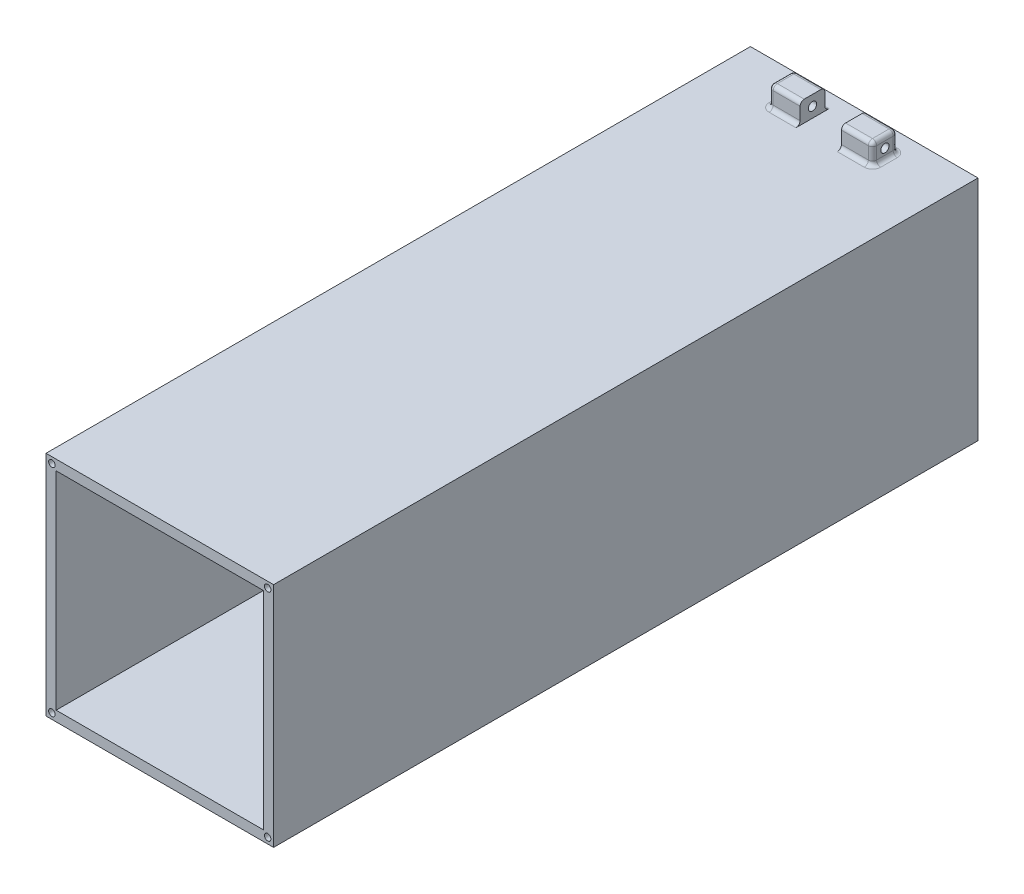
from build123d import *

# Parameters (mm, degrees)
SKETCH1_W                = 110
SKETCH1_H                = 110
SKETCH1_W_2              = 100.2
SKETCH1_H_2              = 100.2
BOSS_EXTRUDE1_DEPTH      = 340.5
CUT_EXTRUDE1_REACH       = 351.271
SKETCH2_R                = 1.575
BOSS_EXTRUDE3_DEPTH      = 30
BOSS_EXTRUDE3_DEPTH_BACK = 30
SKETCH3_W                = 10
SKETCH3_H                = 10
SKETCH4_R                = 1.5
CUT_EXTRUDE2_DEPTH       = 60
SKETCH6_W                = 15
SKETCH6_H                = 12
BOSS_EXTRUDE4_DEPTH      = 10
CUT_EXTRUDE3_REACH       = 357.76
SKETCH7_R                = 2
FILLET1_R                = 2
FILLET2_R                = 3


with BuildPart() as part:
    # Sketch1 → Boss-Extrude1 (new body)
    with BuildSketch(Plane.XY):
        Rectangle(SKETCH1_W, SKETCH1_H)
        Rectangle(SKETCH1_W_2, SKETCH1_H_2, mode=Mode.SUBTRACT)
    extrude(amount=BOSS_EXTRUDE1_DEPTH)

    # Sketch2 → Cut-Extrude1 (cut, up to next)
    with BuildSketch(Plane.XY.offset(340.5), mode=Mode.PRIVATE) as cut_extrude1_sk1:
        with Locations((-52.149125113, 52.149125113)):
            Circle(SKETCH2_R)
    cut_extrude1_tool1 = extrude(cut_extrude1_sk1.sketch, amount=-CUT_EXTRUDE1_REACH, mode=Mode.PRIVATE) & part.part
    # Sketch2 → Cut-Extrude1 (cut, up to next)
    with BuildSketch(Plane.XY.offset(340.5), mode=Mode.PRIVATE) as cut_extrude1_sk2:
        with Locations((52.149125113, 52.149125113)):
            Circle(SKETCH2_R)
    cut_extrude1_tool2 = extrude(cut_extrude1_sk2.sketch, amount=-CUT_EXTRUDE1_REACH, mode=Mode.PRIVATE) & part.part
    # Sketch2 → Cut-Extrude1 (cut, up to next)
    with BuildSketch(Plane.XY.offset(340.5), mode=Mode.PRIVATE) as cut_extrude1_sk3:
        with Locations((52.149125113, -52.149125113)):
            Circle(SKETCH2_R)
    cut_extrude1_tool3 = extrude(cut_extrude1_sk3.sketch, amount=-CUT_EXTRUDE1_REACH, mode=Mode.PRIVATE) & part.part
    # Sketch2 → Cut-Extrude1 (cut, up to next)
    with BuildSketch(Plane.XY.offset(340.5), mode=Mode.PRIVATE) as cut_extrude1_sk4:
        with Locations((-52.149125113, -52.149125113)):
            Circle(SKETCH2_R)
    cut_extrude1_tool4 = extrude(cut_extrude1_sk4.sketch, amount=-CUT_EXTRUDE1_REACH, mode=Mode.PRIVATE) & part.part
    add(cut_extrude1_tool1.solids().sort_by_distance((-52.149125, 52.149125, 340.5))[0], mode=Mode.SUBTRACT)
    add(cut_extrude1_tool2.solids().sort_by_distance((52.149125, 52.149125, 340.5))[0], mode=Mode.SUBTRACT)
    add(cut_extrude1_tool3.solids().sort_by_distance((52.149125, -52.149125, 340.5))[0], mode=Mode.SUBTRACT)
    add(cut_extrude1_tool4.solids().sort_by_distance((-52.149125, -52.149125, 340.5))[0], mode=Mode.SUBTRACT)

    # Sketch3 → Boss-Extrude3 (add, two sides: drawn at the far end of the back side and taken through both)
    with BuildSketch(Plane(origin=(0, 0, 0), x_dir=(0, 0, -1), z_dir=(1, 0, 0)).offset(-BOSS_EXTRUDE3_DEPTH_BACK)):
        with Locations((-5, -60)):
            Rectangle(SKETCH3_W, SKETCH3_H)
    extrude(amount=BOSS_EXTRUDE3_DEPTH + BOSS_EXTRUDE3_DEPTH_BACK)

    # Sketch4 → Cut-Extrude2 (cut)
    with BuildSketch(Plane.ZY.offset(30)):
        with Locations((5, -60)):
            Circle(SKETCH4_R)
    extrude(amount=-CUT_EXTRUDE2_DEPTH, mode=Mode.SUBTRACT)

    # Sketch6 → Boss-Extrude4 (add)
    with BuildSketch(Plane(origin=(0, 55, 0), x_dir=(1, 0, 0), z_dir=(0, 1, 0))):
        with Locations((-17.5, -15)):
            Rectangle(SKETCH6_W, SKETCH6_H)
        with Locations((17.5, -15)):
            Rectangle(SKETCH6_W, SKETCH6_H)
    extrude(amount=BOSS_EXTRUDE4_DEPTH)

    # Cut-Extrude3: up to this face of the body (flat: up to its plane)
    cut_extrude3_end = Plane(part.part.faces().sort_by_distance((25, 60, 15))[0])
    # Sketch7 → Cut-Extrude3 (cut, up to the picked face)
    with BuildSketch(Plane.ZY.offset(25), mode=Mode.PRIVATE) as cut_extrude3_sk1:
        with Locations(Location((15, 60, 0), (0, 0, 270))):
            Circle(SKETCH7_R)
    cut_extrude3_tool1 = split(extrude(cut_extrude3_sk1.sketch, amount=-CUT_EXTRUDE3_REACH, mode=Mode.PRIVATE), bisect_by=cut_extrude3_end, keep=Keep.BOTH, mode=Mode.PRIVATE)
    add(cut_extrude3_tool1.solids().sort_by(Axis((-25, 60, 15), (1, 0, 0)))[0], mode=Mode.SUBTRACT)

    # Fillet1
    fillet1_edges = [part.edges().sort_by_distance(p)[0] for p in [
        (-25, 55, 15),
        (-25, 60, 9),
        (-17.5, 55, 21),
        (-25, 60, 21),
        (-17.5, 55, 9),
        (-25, 65, 15),
        (-17.5, 65, 21),
        (-17.5, 65, 9),
        (17.5, 55, 21),
        (25, 55, 15),
        (25, 60, 21),
        (17.5, 55, 9),
        (25, 60, 9),
        (17.5, 65, 21),
        (25, 65, 15),
        (17.5, 65, 9),
    ]]
    fillet(fillet1_edges, radius=FILLET1_R)

    # Fillet2
    fillet2_edges = [part.edges().sort_by_distance(p)[0] for p in [
        (0, -65, 0),
        (0, -65, 10),
        (0, -55, 10),
    ]]
    fillet(fillet2_edges, radius=FILLET2_R)


solid = part.part
